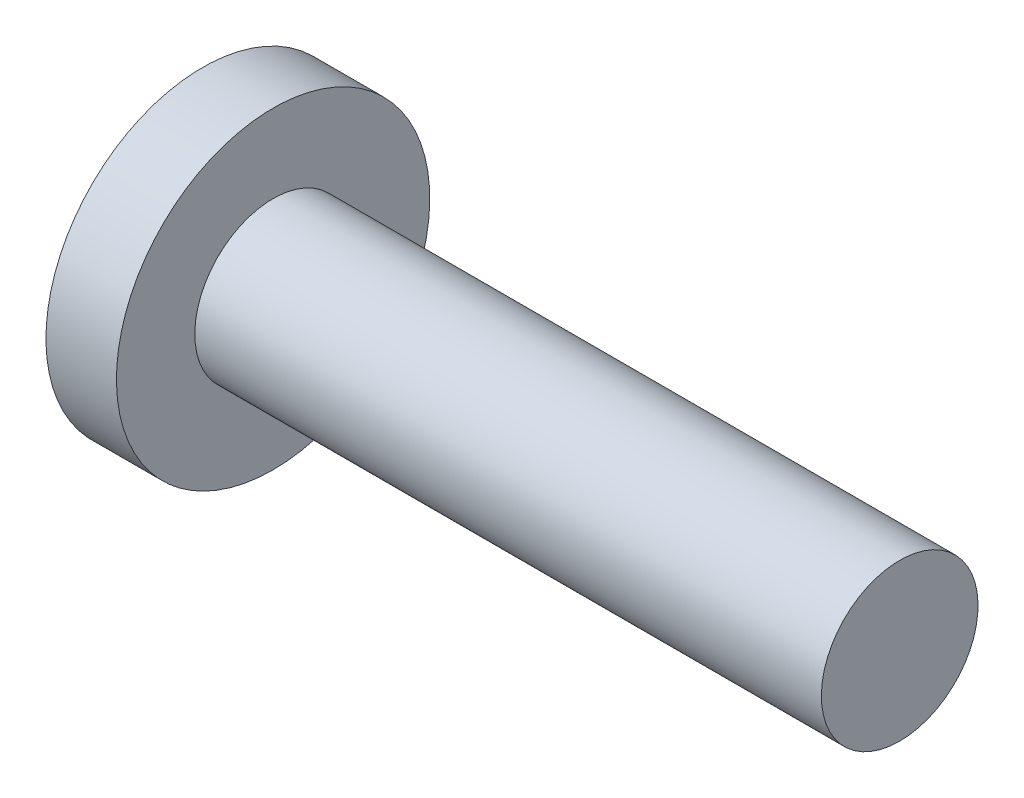
from build123d import *


with BuildPart() as part:
    # 草图1 → 旋转1 (revolve)
    with BuildSketch(Plane.XY, mode=Mode.PRIVATE) as revolve_1_sk:
        Polygon((0, 0), (8, 0), (8, -1), (-0.9, -1), (-0.9, 1), (0, 1), align=None)
    revolve(revolve_1_sk.sketch.rotate(Axis((-0.9, -1, 0), (1, 0, 0)), 180), axis=Axis((-0.9, -1, 0), (1, 0, 0)))


solid = part.part
